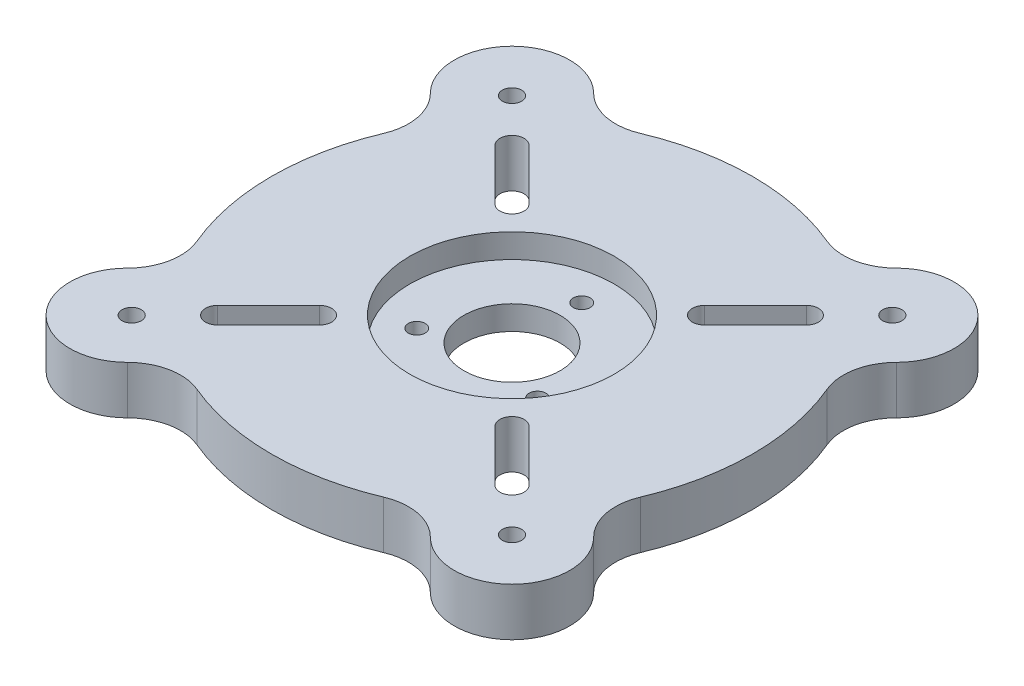
from build123d import *

# Parameters (mm, degrees)
SKETCH1_R           = 2
BOSS_EXTRUDE1_DEPTH = 10
SKETCH2_R           = 21.25
SKETCH2_R_2         = 10
CUT_EXTRUDE5_DEPTH  = 5
SKETCH2_5_R         = 1.75
SKETCH2_5_R_2       = 10
CUT_EXTRUDE6_DEPTH  = 75.1479844


with BuildPart() as part:
    # Sketch1 → Boss-Extrude1 (new body)
    with BuildSketch(Plane(origin=(0, 0, 0), x_dir=(1, 0, 0), z_dir=(0, 1, 0))):
        with BuildLine():
            ThreePointArc((46.077281732, -19.413503243), (50, 0), (46.077281732, 19.413503243))
            ThreePointArc((46.077281732, 19.413503243), (45.41900176, 25.799706685), (48.436814511, 31.466251763))
            ThreePointArc((48.436814511, 31.466251763), (48.436814511, 48.436814511), (31.466251763, 48.436814511))
            ThreePointArc((31.466251763, 48.436814511), (25.799706685, 45.41900176), (19.413503243, 46.077281732))
            ThreePointArc((19.413503243, 46.077281732), (0, 50), (-19.413503243, 46.077281732))
            ThreePointArc((-19.413503243, 46.077281732), (-25.799706685, 45.41900176), (-31.466251763, 48.436814511))
            ThreePointArc((-31.466251763, 48.436814511), (-48.436814511, 48.436814511), (-48.436814511, 31.466251763))
            ThreePointArc((-48.436814511, 31.466251763), (-45.41900176, 25.799706685), (-46.077281732, 19.413503243))
            ThreePointArc((-46.077281732, 19.413503243), (-50, 0), (-46.077281732, -19.413503243))
            ThreePointArc((-46.077281732, -19.413503243), (-45.41900176, -25.799706685), (-48.436814511, -31.466251763))
            ThreePointArc((-48.436814511, -31.466251763), (-48.436814511, -48.436814511), (-31.466251763, -48.436814511))
            ThreePointArc((-31.466251763, -48.436814511), (-25.799706685, -45.41900176), (-19.413503243, -46.077281732))
            ThreePointArc((-19.413503243, -46.077281732), (0, -50), (19.413503243, -46.077281732))
            ThreePointArc((19.413503243, -46.077281732), (25.799706685, -45.41900176), (31.466251763, -48.436814511))
            ThreePointArc((31.466251763, -48.436814511), (48.436814511, -48.436814511), (48.436814511, -31.466251763))
            ThreePointArc((48.436814511, -31.466251763), (45.41900176, -25.799706685), (46.077281732, -19.413503243))
        make_face()
        with BuildLine():
            ThreePointArc((-21.767766953, -18.232233047), (-18.232233047, -18.232233047), (-18.232233047, -21.767766953))
            Line((-18.232233047, -21.767766953), (-28.838834765, -32.374368671))
            ThreePointArc((-28.838834765, -32.374368671), (-32.374368671, -32.374368671), (-32.374368671, -28.838834765))
            Line((-32.374368671, -28.838834765), (-21.767766953, -18.232233047))
        make_face(mode=Mode.SUBTRACT)
        with BuildLine():
            ThreePointArc((18.232233047, -21.767766953), (18.232233047, -18.232233047), (21.767766953, -18.232233047))
            Line((21.767766953, -18.232233047), (32.374368671, -28.838834765))
            ThreePointArc((32.374368671, -28.838834765), (32.374368671, -32.374368671), (28.838834765, -32.374368671))
            Line((28.838834765, -32.374368671), (18.232233047, -21.767766953))
        make_face(mode=Mode.SUBTRACT)
        with BuildLine():
            ThreePointArc((-18.232233047, 21.767766953), (-18.232233047, 18.232233047), (-21.767766953, 18.232233047))
            Line((-21.767766953, 18.232233047), (-32.374368671, 28.838834765))
            ThreePointArc((-32.374368671, 28.838834765), (-32.374368671, 32.374368671), (-28.838834765, 32.374368671))
            Line((-28.838834765, 32.374368671), (-18.232233047, 21.767766953))
        make_face(mode=Mode.SUBTRACT)
        with BuildLine():
            ThreePointArc((21.767766953, 18.232233047), (18.232233047, 18.232233047), (18.232233047, 21.767766953))
            Line((18.232233047, 21.767766953), (28.838834765, 32.374368671))
            ThreePointArc((28.838834765, 32.374368671), (32.374368671, 32.374368671), (32.374368671, 28.838834765))
            Line((32.374368671, 28.838834765), (21.767766953, 18.232233047))
        make_face(mode=Mode.SUBTRACT)
        with Locations((39.531158056, -39.531158056)):
            Circle(SKETCH1_R, mode=Mode.SUBTRACT)
        with Locations((-39.531158056, -39.531158056)):
            Circle(SKETCH1_R, mode=Mode.SUBTRACT)
        with Locations((-39.531158056, 39.531158056)):
            Circle(SKETCH1_R, mode=Mode.SUBTRACT)
        with Locations((39.531158056, 39.531158056)):
            Circle(SKETCH1_R, mode=Mode.SUBTRACT)
    extrude(amount=BOSS_EXTRUDE1_DEPTH)

    # Sketch2 → Cut-Extrude5 (cut)
    with BuildSketch(Plane(origin=(0, 10, 0), x_dir=(1, 0, 0), z_dir=(0, 1, 0))):
        Circle(SKETCH2_R)
        Circle(SKETCH2_R_2, mode=Mode.SUBTRACT)
    extrude(amount=-CUT_EXTRUDE5_DEPTH, mode=Mode.SUBTRACT)

    # Sketch2<5> → Cut-Extrude6 (cut, through all)
    with BuildSketch(Plane(origin=(0, 10, 0), x_dir=(1, 0, 0), z_dir=(0, 1, 0))):
        with Locations((0, 14.5)):
            Circle(SKETCH2_5_R)
        with Locations((12.557368355, -7.25)):
            Circle(SKETCH2_5_R)
        with Locations((-12.557368355, -7.25)):
            Circle(SKETCH2_5_R)
        Circle(SKETCH2_5_R_2)
    extrude(amount=-CUT_EXTRUDE6_DEPTH, mode=Mode.SUBTRACT)


solid = part.part
